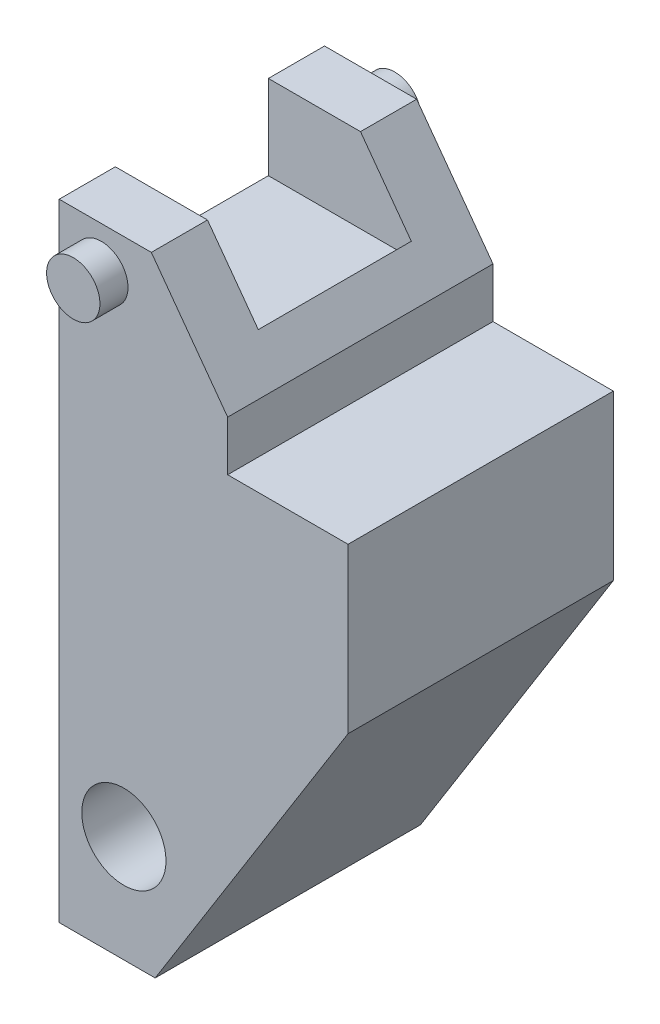
from build123d import *

# Parameters (mm, degrees)
SKETCH1_W           = 20.576108637
SKETCH1_H           = 33.628117847
SKETCH1_R           = 5.1
SKETCH1_R_2         = 1.6
BOSS_EXTRUDE1_DEPTH = 18.9
SKETCH3_W           = 12
SKETCH3_H           = 18.9
BOSS_EXTRUDE3_DEPTH = 11
SKETCH4_R           = 1.9
BOSS_EXTRUDE6_DEPTH = 2
BOSS_EXTRUDE7_START = 2
SKETCH5_R           = 1.9
BOSS_EXTRUDE7_DEPTH = 2
CUT_EXTRUDE1_DEPTH  = 40.488623232
CUT_EXTRUDE2_DEPTH  = 40.488623232
SKETCH8_W           = 10.181570082
SKETCH8_H           = 10.9
CUT_EXTRUDE3_DEPTH  = 6
SKETCH9_R           = 6.144425542
BOSS_EXTRUDE8_DEPTH = 10
SKETCH10_R          = 3
CUT_EXTRUDE4_DEPTH  = 6


with BuildPart() as part:
    # Sketch1 → Boss-Extrude1 (new body)
    with BuildSketch(Plane.XY):
        with Locations((9.059629922, -0.460659149)):
            Rectangle(SKETCH1_W, SKETCH1_H)
        with Locations((8.525263921, 7.417965689)):
            Circle(SKETCH1_R, mode=Mode.SUBTRACT)
        with Locations((3.37816709, -9.67384212)):
            Circle(SKETCH1_R_2, mode=Mode.SUBTRACT)
    extrude(amount=BOSS_EXTRUDE1_DEPTH)

    # Sketch3 → Boss-Extrude3 (add)
    with BuildSketch(Plane(origin=(0, 16.353399775, 0), x_dir=(1, 0, 0), z_dir=(0, 1, 0))):
        with Locations((4.771575604, -9.45)):
            Rectangle(SKETCH3_W, SKETCH3_H)
    extrude(amount=BOSS_EXTRUDE3_DEPTH)

    # Sketch4 → Boss-Extrude6 (add)
    with BuildSketch(Plane.XY.offset(18.9)):
        with Locations((1.771575604, 24.353399775)):
            Circle(SKETCH4_R)
    extrude(amount=BOSS_EXTRUDE6_DEPTH)

    # Sketch5 → Boss-Extrude7 (add)
    with BuildSketch(Plane(origin=(0, 0, 0), x_dir=(-1, 0, 0), z_dir=(0, 0, -1)).offset(BOSS_EXTRUDE7_START)):
        with Locations(Location((-1.771575604, 24.353399775, 0), (0, 0, 180))):
            Circle(SKETCH5_R)
    extrude(amount=-BOSS_EXTRUDE7_DEPTH)

    # Sketch6 → Cut-Extrude1 (cut, through all)
    with BuildSketch(Plane.XY.offset(18.9)):
        Polygon((5.606824739, -17.274718072), (19.347684241, 4.666075764), (19.347684241, -17.274718072), align=None)
    extrude(amount=-CUT_EXTRUDE1_DEPTH, mode=Mode.SUBTRACT)

    # Sketch7 → Cut-Extrude2 (cut, through all)
    with BuildSketch(Plane.XY.offset(18.9)):
        Polygon((5.334321987, 27.353399775), (10.771575604, 19.908581769), (10.771575604, 27.353399775), align=None)
    extrude(amount=-CUT_EXTRUDE2_DEPTH, mode=Mode.SUBTRACT)

    # Sketch8 → Cut-Extrude3 (cut)
    with BuildSketch(Plane(origin=(0, 27.353399775, 0), x_dir=(1, 0, 0), z_dir=(0, 1, 0))):
        with Locations((3.862360645, -9.45)):
            Rectangle(SKETCH8_W, SKETCH8_H)
    extrude(amount=-CUT_EXTRUDE3_DEPTH, mode=Mode.SUBTRACT)

    # Sketch9 → Boss-Extrude8 (add)
    with BuildSketch(Plane.XY.offset(18.9)):
        with Locations((8.525263921, 7.417965689)):
            Circle(SKETCH9_R)
    extrude(amount=-BOSS_EXTRUDE8_DEPTH)

    # Sketch10 → Cut-Extrude4 (cut)
    with BuildSketch(Plane.XY.offset(18.9)):
        with Locations((3.37816709, -9.67384212)):
            Circle(SKETCH10_R)
    extrude(amount=-CUT_EXTRUDE4_DEPTH, mode=Mode.SUBTRACT)


solid = part.part
